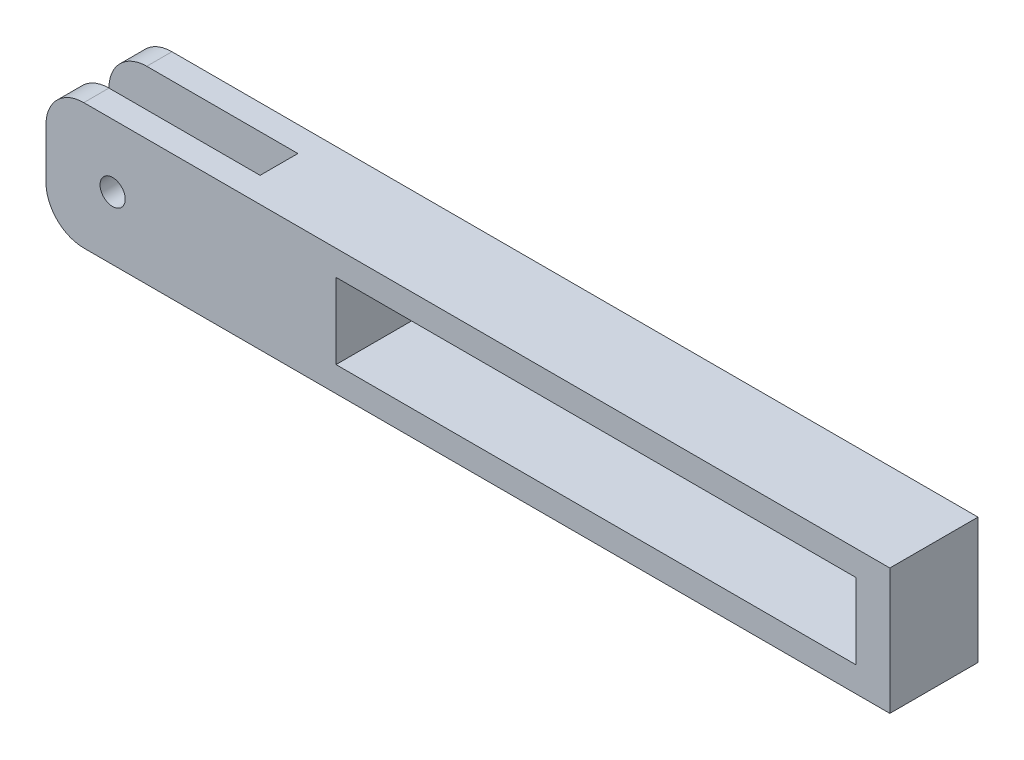
from build123d import *

# Parameters (mm, degrees)
SKETCH3_W           = 206.383928572
SKETCH3_H           = 30
BOSS_EXTRUDE1_DEPTH = 35
CUT_EXTRUDE2_REACH  = 180.273
SKETCH5_W           = 75
SKETCH5_H           = 15
SKETCH6_R           = 5
CUT_EXTRUDE3_DEPTH  = 173.934236055


with BuildPart() as part:
    # Sketch3 → Boss-Extrude1 (new body)
    with BuildSketch(Plane.XY):
        with BuildLine():
            Line((-167.5, 10), (-167.5, -10))
            ThreePointArc((-167.5, -10), (-163.106601718, -20.606601718), (-152.5, -25))
            Line((-152.5, -25), (167.5, -25))
            Line((167.5, -25), (167.5, 25))
            Line((167.5, 25), (-152.5, 25))
            ThreePointArc((-152.5, 25), (-163.106601718, 20.606601718), (-167.5, 10))
        make_face()
        with Locations((50.825520553, 0)):
            Rectangle(SKETCH3_W, SKETCH3_H, mode=Mode.SUBTRACT)
    extrude(amount=BOSS_EXTRUDE1_DEPTH)

    # Sketch5 → Cut-Extrude2 (cut, up to next)
    with BuildSketch(Plane.XZ.offset(25), mode=Mode.PRIVATE) as cut_extrude2_sk1:
        with Locations((-130, 17.5)):
            Rectangle(SKETCH5_W, SKETCH5_H)
    cut_extrude2_tool1 = extrude(cut_extrude2_sk1.sketch, amount=-CUT_EXTRUDE2_REACH, mode=Mode.PRIVATE) & part.part
    add(cut_extrude2_tool1.solids().sort_by_distance((-130, -25, 17.5))[0], mode=Mode.SUBTRACT)

    # Sketch6 → Cut-Extrude3 (cut, through all)
    with BuildSketch(Plane(origin=(0, 0, 0), x_dir=(-1, 0, 0), z_dir=(0, 0, -1))):
        with Locations((141.050190179, 0)):
            Circle(SKETCH6_R)
    extrude(amount=-CUT_EXTRUDE3_DEPTH, mode=Mode.SUBTRACT)


solid = part.part
